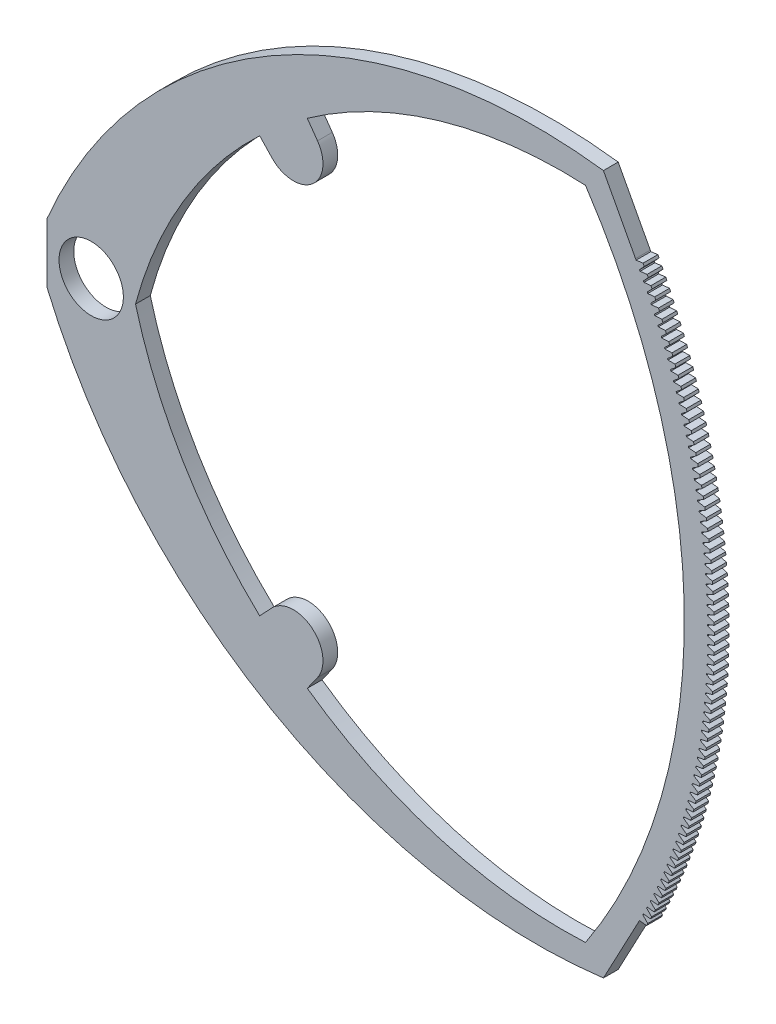
from build123d import *

# Parameters (mm, degrees)
SKETCH3_R           = 10.9
BOSS_EXTRUDE2_DEPTH = 5


with BuildPart() as part:
    # Sketch3 → Boss-Extrude2 (new body)
    with BuildSketch(Plane.XY):
        with BuildLine():
            Line((-15, -10), (-15, 10))
            ThreePointArc((-15, 10), (61.011584586, 95.857487867), (173.446009936, 118.391222805))
            Line((173.446009936, 118.391222805), (184.315310009, 98.002188732))
            ThreePointArc((184.315310009, 98.002188732), (184.412613698, 97.818967533), (184.509735253, 97.635649724))
            Line((184.509735253, 97.635649724), (186.879817898, 97.963940623))
            ThreePointArc((186.879817898, 97.963940623), (187.08601239, 97.569585261), (187.291374711, 97.174795903))
            Line((187.291374711, 97.174795903), (185.665667925, 95.419192273))
            ThreePointArc((185.665667925, 95.419192273), (185.760403961, 95.234630363), (185.854956533, 95.049974394))
            Line((185.854956533, 95.049974394), (188.229391809, 95.345141771))
            ThreePointArc((188.229391809, 95.345141771), (188.430060141, 94.947945925), (188.629890324, 94.550327744))
            Line((188.629890324, 94.550327744), (186.97982995, 92.817593655))
            ThreePointArc((186.97982995, 92.817593655), (187.071979865, 92.631727013), (187.16394502, 92.445768883))
            Line((187.16394502, 92.445768883), (189.542270026, 92.707755195))
            ThreePointArc((189.542270026, 92.707755195), (189.737373078, 92.307796299), (189.931632165, 91.907426811))
            Line((189.931632165, 91.907426811), (188.257539887, 90.197900062))
            ThreePointArc((188.257539887, 90.197900062), (188.347085716, 90.010764924), (188.436445526, 89.823540887))
            Line((188.436445526, 89.823540887), (190.818196602, 90.052295059))
            ThreePointArc((190.818196602, 90.052295059), (191.007696338, 89.649651085), (191.196346459, 89.246608343))
            Line((191.196346459, 89.246608343), (189.498548644, 87.560622211))
            ThreePointArc((189.498548644, 87.560622211), (189.58547293, 87.372255058), (189.672209973, 87.183801614))
            Line((189.672209973, 87.183801614), (192.056922793, 87.379279049))
            ThreePointArc((192.056922793, 87.379279049), (192.240782269, 86.974028494), (192.423786646, 86.568391072))
            Line((192.423786646, 86.568391072), (190.702614283, 84.906274242))
            ThreePointArc((190.702614283, 84.906274242), (190.78690008, 84.716711799), (190.870997448, 84.527065685))
            Line((190.870997448, 84.527065685), (193.258207106, 84.689228276))
            ThreePointArc((193.258207106, 84.689228276), (193.436390479, 84.281450144), (193.613713434, 83.873297122))
            Line((193.613713434, 83.873297122), (191.86950207, 82.235373627))
            ThreePointArc((191.86950207, 82.235373627), (191.951132946, 82.044652848), (192.032574243, 81.853851038))
            Line((192.032574243, 81.853851038), (194.421815349, 81.98266717))
            ThreePointArc((194.421815349, 81.98266717), (194.594287882, 81.572440958), (194.765894846, 81.161851906))
            Line((194.765894846, 81.161851906), (192.998984517, 79.548441063))
            ThreePointArc((192.998984517, 79.548441063), (193.077944558, 79.35659913), (193.156713907, 79.16467882))
            Line((193.156713907, 79.16467882), (195.547520674, 79.260123381))
            ThreePointArc((195.547520674, 79.260123381), (195.714248742, 78.847529063), (195.88010626, 78.434584027))
            Line((195.88010626, 78.434584027), (194.090841429, 76.846000373))
            ThreePointArc((194.090841429, 76.846000373), (194.167115242, 76.653074685), (194.243197287, 76.460073291))
            Line((194.243197287, 76.460073291), (196.635103622, 76.522127673))
            ThreePointArc((196.635103622, 76.522127673), (196.796054722, 76.107245686), (196.95613046, 75.692025169))
            Line((196.95613046, 75.692025169), (195.144859948, 74.128578403))
            ThreePointArc((195.144859948, 74.128578403), (195.218432662, 73.934606572), (195.291812571, 73.74056172))
            Line((195.291812571, 73.74056172), (197.684352167, 73.769213825))
            ThreePointArc((197.684352167, 73.769213825), (197.839494921, 73.352125051), (197.993757672, 72.934710002))
            Line((197.993757672, 72.934710002), (196.160834589, 71.396704919))
            ThreePointArc((196.160834589, 71.396704919), (196.231691862, 71.20172476), (196.302355329, 71.00667428))
            Line((196.302355329, 71.00667428), (198.695061756, 71.001918523))
            ThreePointArc((198.695061756, 71.001918523), (198.844365918, 70.582704274), (198.992785608, 70.163176068))
            Line((198.992785608, 70.163176068), (197.138567287, 68.650912507))
            ThreePointArc((197.138567287, 68.650912507), (197.206695305, 68.454962032), (197.274628554, 68.258943948))
            Line((197.274628554, 68.258943948), (199.667035348, 68.220781256))
            ThreePointArc((199.667035348, 68.220781256), (199.810471813, 67.799523258), (199.953019507, 67.377963684))
            Line((199.953019507, 67.377963684), (198.077867431, 65.891736463))
            ThreePointArc((198.077867431, 65.891736463), (198.143252912, 65.694853872), (198.208442699, 65.497906399))
            Line((198.208442699, 65.497906399), (200.600083457, 65.426344212))
            ThreePointArc((200.600083457, 65.426344212), (200.737624259, 65.003124591), (200.874272168, 64.579615833))
            Line((200.874272168, 64.579615833), (198.978551902, 63.119714694))
            ThreePointArc((198.978551902, 63.119714694), (199.0411821, 62.921938371), (199.103615716, 62.724099904))
            Line((199.103615716, 62.724099904), (201.494024182, 62.619152173))
            ThreePointArc((201.494024182, 62.619152173), (201.625642509, 62.194053437), (201.756363992, 61.768678057))
            Line((201.756363992, 61.768678057), (199.84044511, 60.335387612))
            ThreePointArc((199.84044511, 60.335387612), (199.900307814, 60.136756114), (199.959973088, 59.938065222))
            Line((199.959973088, 59.938065222), (202.348683248, 59.799752406))
            ThreePointArc((202.348683248, 59.799752406), (202.47435344, 59.372857428), (202.599123012, 58.945698355))
            Line((202.599123012, 58.945698355), (200.663379027, 57.539298027))
            ThreePointArc((200.663379027, 57.539298027), (200.720462567, 57.339850076), (200.777347868, 57.140345494))
            Line((200.777347868, 57.140345494), (203.163894037, 56.968694559))
            ThreePointArc((203.163894037, 56.968694559), (203.283591594, 56.540086563), (203.402384933, 56.111227073))
            Line((203.402384933, 56.111227073), (201.447193221, 54.731991041))
            ThreePointArc((201.447193221, 54.731991041), (201.501486469, 54.531765521), (201.555580705, 54.331486144))
            Line((201.555580705, 54.331486144), (203.939497622, 54.126530553))
            ThreePointArc((203.939497622, 54.126530553), (204.05319921, 53.696293096), (204.165993155, 53.265816796))
            Line((204.165993155, 53.265816796), (202.191734886, 51.914013946))
            ThreePointArc((202.191734886, 51.914013946), (202.243227256, 51.713049891), (202.294519883, 51.512034762))
            Line((202.294519883, 51.512034762), (204.675342798, 51.273814471))
            ThreePointArc((204.675342798, 51.273814471), (204.78302625, 50.842031431), (204.889798813, 50.410022242))
            Line((204.889798813, 50.410022242), (202.896858871, 49.08591611))
            ThreePointArc((202.896858871, 49.08591611), (202.945540326, 48.884252699), (202.994021343, 48.682541007))
            Line((202.994021343, 48.682541007), (205.371286111, 48.411102458))
            ThreePointArc((205.371286111, 48.411102458), (205.472930433, 47.977858011), (205.573660798, 47.544400154))
            Line((205.573660798, 47.544400154), (203.562427711, 46.248248878))
            ThreePointArc((203.562427711, 46.248248878), (203.60828876, 46.045925425), (203.653948717, 45.843556495))
            Line((203.653948717, 45.843556495), (206.027191884, 45.538952605))
            ThreePointArc((206.027191884, 45.538952605), (206.122777261, 45.104331212), (206.217445791, 44.669509192))
            Line((206.217445791, 44.669509192), (204.188311653, 43.401565458))
            ThreePointArc((204.188311653, 43.401565458), (204.231343355, 43.198621406), (204.27417335, 42.99563469))
            Line((204.27417335, 42.99563469), (206.642932248, 42.657924843))
            ThreePointArc((206.642932248, 42.657924843), (206.732440046, 42.222011234), (206.821028284, 41.78590982))
            Line((206.821028284, 41.78590982), (204.774388679, 40.546420817))
            ThreePointArc((204.774388679, 40.546420817), (204.814582645, 40.342895731), (204.854574327, 40.139330801))
            Line((204.854574327, 40.139330801), (207.218387163, 39.768580833))
            ThreePointArc((207.218387163, 39.768580833), (207.301799932, 39.331459992), (207.384290608, 38.894164202))
            Line((207.384290608, 38.894164202), (205.320544532, 37.683371571))
            ThreePointArc((205.320544532, 37.683371571), (205.357892926, 37.479305128), (205.3950385, 37.27520167))
            Line((205.3950385, 37.27520167), (207.753444443, 36.87148386))
            ThreePointArc((207.753444443, 36.87148386), (207.830745921, 36.433241004), (207.907122954, 35.99483609))
            Line((207.907122954, 35.99483609), (205.826672738, 34.812975877))
            ThreePointArc((205.826672738, 34.812975877), (205.861168279, 34.608407861), (205.895460503, 34.403805664))
            Line((205.895460503, 34.403805664), (208.247999777, 33.967198718))
            ThreePointArc((208.247999777, 33.967198718), (208.319174894, 33.527919283), (208.389423394, 33.088490713))
            Line((208.389423394, 33.088490713), (206.292674627, 31.935793324))
            ThreePointArc((206.292674627, 31.935793324), (206.32431059, 31.730763616), (206.355742778, 31.525702569))
            Line((206.355742778, 31.525702569), (208.701956751, 31.056291604))
            ThreePointArc((208.701956751, 31.056291604), (208.766991632, 30.616061228), (208.831097903, 30.17569467))
            Line((208.831097903, 30.17569467), (206.71845935, 29.052384825))
            ThreePointArc((206.71845935, 29.052384825), (206.747229567, 28.846933395), (206.775795592, 28.641453475))
            Line((206.775795592, 28.641453475), (209.115226865, 28.139330004))
            ThreePointArc((209.115226865, 28.139330004), (209.17410883, 27.698234511), (209.232060375, 27.257015815))
            Line((209.232060375, 27.257015815), (207.103943899, 26.163312507))
            ThreePointArc((207.103943899, 26.163312507), (207.129842762, 25.957479408), (207.155537055, 25.751620673))
            Line((207.155537055, 25.751620673), (209.487729552, 25.216882586))
            ThreePointArc((209.487729552, 25.216882586), (209.540447122, 24.775007968), (209.592232643, 24.33302315))
            Line((209.592232643, 24.33302315), (207.449053125, 23.269139598))
            ThreePointArc((207.449053125, 23.269139598), (207.472075584, 23.062964959), (207.494893136, 22.856767541))
            Line((207.494893136, 22.856767541), (209.81939219, 22.289519086))
            ThreePointArc((209.81939219, 22.289519086), (209.865935089, 21.846951489), (209.91154449, 21.404286715))
            Line((209.91154449, 21.404286715), (207.753719746, 20.370430325))
            ThreePointArc((207.753719746, 20.370430325), (207.773861314, 20.163954339), (207.793797676, 19.957458438))
            Line((207.793797676, 19.957458438), (210.110150122, 19.357810201))
            ThreePointArc((210.110150122, 19.357810201), (210.150509275, 18.914635903), (210.189933666, 18.471377471))
            Line((210.189933666, 18.471377471), (208.017884368, 17.467749796))
            ThreePointArc((208.017884368, 17.467749796), (208.035141118, 17.261012716), (208.052192404, 17.054258588))
            Line((208.052192404, 17.054258588), (210.359946664, 16.422327472))
            ThreePointArc((210.359946664, 16.422327472), (210.394114204, 15.978632871), (210.427345897, 15.534867196))
            Line((210.427345897, 15.534867196), (208.241495492, 14.561663894))
            ThreePointArc((208.241495492, 14.561663894), (208.255864059, 14.354706024), (208.270026944, 14.147733977))
            Line((208.270026944, 14.147733977), (210.568733117, 13.483643178))
            ThreePointArc((210.568733117, 13.483643178), (210.596702383, 13.039514773), (210.6237349, 12.595328368))
            Line((210.6237349, 12.595328368), (208.424509523, 11.652739167))
            ThreePointArc((208.424509523, 11.652739167), (208.435987107, 11.445600855), (208.44725883, 11.238451238))
            Line((208.44725883, 11.238451238), (210.736468779, 10.542330221))
            ThreePointArc((210.736468779, 10.542330221), (210.758234317, 10.097854596), (210.779062389, 9.653334055))
            Line((210.779062389, 9.653334055), (208.566890783, 8.741542716))
            ThreePointArc((208.566890783, 8.741542716), (208.575475145, 8.534264342), (208.58385351, 8.326977539))
            Line((208.58385351, 8.326977539), (210.863120949, 7.598962016))
            ThreePointArc((210.863120949, 7.598962016), (210.878678517, 7.154225822), (210.893298082, 6.709457806))
            Line((210.893298082, 6.709457806), (208.668611515, 5.828642084))
            ThreePointArc((208.668611515, 5.828642084), (208.674300982, 5.621264058), (208.679784354, 5.413880481))
            Line((208.679784354, 5.413880481), (210.948664935, 4.654112378))
            ThreePointArc((210.948664935, 4.654112378), (210.9580115, 4.209202318), (210.966419709, 3.764273535))
            Line((210.966419709, 3.764273535), (208.729651887, 2.914605146))
            ThreePointArc((208.729651887, 2.914605146), (208.73244535, 2.707167897), (208.735032661, 2.499727975))
            Line((208.735032661, 2.499727975), (210.993084062, 1.708355411))
            ThreePointArc((210.993084062, 1.708355411), (210.9962178, 1.263358221), (210.998413014, 0.818355411))
            Line((210.998413014, 0.818355411), (208.75, 0))
            ThreePointArc((208.75, 0), (208.749896915, -0.207456031), (208.74958766, -0.414911858))
            Line((208.74958766, -0.414911858), (210.996369668, -1.237734602))
            ThreePointArc((210.996369668, -1.237734602), (210.99328997, -1.68273217), (210.98927176, -2.127722252))
            Line((210.98927176, -2.127722252), (208.729651887, -2.914605146))
            ThreePointArc((208.729651887, -2.914605146), (208.726652273, -3.122039516), (208.723446513, -3.329470802))
            Line((208.723446513, -3.329470802), (210.958521114, -4.183583317))
            ThreePointArc((210.958521114, -4.183583317), (210.94922858, -4.628494509), (210.93899773, -5.073385112))
            Line((210.93899773, -5.073385112), (208.668611515, -5.828642084))
            ThreePointArc((208.668611515, -5.828642084), (208.662715957, -6.036014353), (208.656614316, -6.24338066))
            Line((208.656614316, -6.24338066), (210.879545778, -7.128616434))
            ThreePointArc((210.879545778, -7.128616434), (210.86404222, -7.573354513), (210.847600725, -8.018058906))
            Line((210.847600725, -8.018058906), (208.566890783, -8.741542716))
            ThreePointArc((208.566890783, -8.741542716), (208.558100432, -8.948812456), (208.549104099, -9.156073358))
            Line((208.549104099, -9.156073358), (210.759459058, -10.072259813))
            ThreePointArc((210.759459058, -10.072259813), (210.737747497, -10.516738078), (210.715098562, -10.961169563))
            Line((210.715098562, -10.961169563), (208.424509523, -11.652739167))
            ThreePointArc((208.424509523, -11.652739167), (208.412826091, -11.859865971), (208.400936821, -12.066981062))
            Line((208.400936821, -12.066981062), (210.598284363, -13.013939585))
            ThreePointArc((210.598284363, -13.013939585), (210.570369033, -13.458071383), (210.541517072, -13.902143319))
            Line((210.541517072, -13.902143319), (208.241495492, -14.561663894))
            ThreePointArc((208.241495492, -14.561663894), (208.226921257, -14.768607382), (208.212141368, -14.975536284))
            Line((208.212141368, -14.975536284), (210.396053115, -15.953082264))
            ThreePointArc((210.396053115, -15.953082264), (210.361939458, -16.396781011), (210.326890097, -16.840406824))
            Line((210.326890097, -16.840406824), (208.017884368, -17.467749796))
            ThreePointArc((208.017884368, -17.467749796), (208.000422172, -17.674469623), (207.982754545, -17.881171995))
            Line((207.982754545, -17.881171995), (210.15280474, -18.889114857))
            ThreePointArc((210.15280474, -18.889114857), (210.112499406, -19.332294053), (210.071259478, -19.775387258))
            Line((210.071259478, -19.775387258), (207.753719746, -20.370430325))
            ThreePointArc((207.753719746, -20.370430325), (207.733372992, -20.576886192), (207.712821072, -20.783321737))
            Line((207.712821072, -20.783321737), (209.868586659, -21.821464981))
            ThreePointArc((209.868586659, -21.821464981), (209.822097506, -22.264038227), (209.774675051, -22.706512442))
            Line((209.774675051, -22.706512442), (207.449053125, -23.269139598))
            ThreePointArc((207.449053125, -23.269139598), (207.42582578, -23.475291256), (207.402393573, -23.681419728))
            Line((207.402393573, -23.681419728), (209.543454281, -24.749560966))
            ThreePointArc((209.543454281, -24.749560966), (209.490790372, -25.191441982), (209.437194635, -25.633210945))
            Line((209.437194635, -25.633210945), (207.103943899, -26.163312507))
            ThreePointArc((207.103943899, -26.163312507), (207.077840492, -26.369119765), (207.051532566, -26.57490098))
            Line((207.051532566, -26.57490098), (209.177470992, -27.672831976))
            ThreePointArc((209.177470992, -27.672831976), (209.118642594, -28.113934616), (209.058884023, -28.554912204))
            Line((209.058884023, -28.554912204), (206.71845935, -29.052384825))
            ThreePointArc((206.71845935, -29.052384825), (206.689484969, -29.257807562), (206.660306453, -29.463201403))
            Line((206.660306453, -29.463201403), (208.77070814, -30.590708112))
            ThreePointArc((208.77070814, -30.590708112), (208.705726722, -31.030946383), (208.639816968, -31.471046626))
            Line((208.639816968, -31.471046626), (206.292674627, -31.935793324))
            ThreePointArc((206.292674627, -31.935793324), (206.260834921, -32.140791492), (206.228791503, -32.345757916))
            Line((206.228791503, -32.345757916), (208.323245025, -33.502620529))
            ThreePointArc((208.323245025, -33.502620529), (208.252123255, -33.941908605), (208.180075166, -34.381045705))
            Line((208.180075166, -34.381045705), (205.826672738, -34.812975877))
            ThreePointArc((205.826672738, -34.812975877), (205.791973915, -35.01750951), (205.757071842, -35.222008559))
            Line((205.757071842, -35.222008559), (207.83516888, -36.408001544))
            ThreePointArc((207.83516888, -36.408001544), (207.757920624, -36.846253785), (207.679748247, -37.284342131))
            Line((207.679748247, -37.284342131), (205.320544532, -37.683371571))
            ThreePointArc((205.320544532, -37.683371571), (205.282993355, -37.887400796), (205.245239432, -38.091392602))
            Line((205.245239432, -38.091392602), (207.306574858, -39.306284747))
            ThreePointArc((207.306574858, -39.306284747), (207.223215175, -39.743415714), (207.138933749, -40.1803699))
            Line((207.138933749, -40.1803699), (204.774388679, -40.546420817))
            ThreePointArc((204.774388679, -40.546420817), (204.73399247, -40.749905858), (204.693394056, -40.953350652))
            Line((204.693394056, -40.953350652), (206.737566008, -42.196905111))
            ThreePointArc((206.737566008, -42.196905111), (206.648111149, -42.632829586), (206.557737106, -43.068564427))
            Line((206.557737106, -43.068564427), (204.188311653, -43.401565458))
            ThreePointArc((204.188311653, -43.401565458), (204.145078287, -43.604466645), (204.101643298, -43.807324766))
            Line((204.101643298, -43.807324766), (206.12825326, -45.079299106))
            ThreePointArc((206.12825326, -45.079299106), (206.032720665, -45.513932103), (205.936271622, -45.948362652))
            Line((205.936271622, -45.948362652), (203.562427711, -46.248248878))
            ThreePointArc((203.562427711, -46.248248878), (203.516365616, -46.450526655), (203.470102519, -46.652758555))
            Line((203.470102519, -46.652758555), (205.478755401, -47.952904801))
            ThreePointArc((205.478755401, -47.952904801), (205.377163693, -48.386161589), (205.274658454, -48.819203153))
            Line((205.274658454, -48.819203153), (202.896858871, -49.08591611))
            ThreePointArc((202.896858871, -49.08591611), (202.847977027, -49.287531042), (202.798894841, -49.489097296))
            Line((202.798894841, -49.489097296), (204.789199051, -50.817161983))
            ThreePointArc((204.789199051, -50.817161983), (204.681568037, -51.248958097), (204.573026585, -51.680526253))
            Line((204.573026585, -51.680526253), (202.191734886, -51.914013946))
            ThreePointArc((202.191734886, -51.914013946), (202.140042822, -52.114926728), (202.088151117, -52.31578804))
            Line((202.088151117, -52.31578804), (204.059718641, -53.671512259))
            ThreePointArc((204.059718641, -53.671512259), (203.946069303, -54.101763519), (203.831512799, -54.531774132))
            Line((203.831512799, -54.531774132), (201.447193221, -54.731991041))
            ThreePointArc((201.447193221, -54.731991041), (201.392701016, -54.932162506), (201.338009907, -55.132279717))
            Line((201.338009907, -55.132279717), (203.290456385, -56.515399166))
            ThreePointArc((203.290456385, -56.515399166), (203.170810879, -56.944021696), (203.050261656, -57.372390934))
            Line((203.050261656, -57.372390934), (200.663379027, -57.539298027))
            ThreePointArc((200.663379027, -57.539298027), (200.606097303, -57.738689149), (200.548617453, -57.938023246))
            Line((200.548617453, -57.938023246), (202.481562251, -59.348268285))
            ThreePointArc((202.481562251, -59.348268285), (202.355943903, -59.775178522), (202.229425462, -60.201822875))
            Line((202.229425462, -60.201822875), (199.84044511, -60.335387612))
            ThreePointArc((199.84044511, -60.335387612), (199.780385035, -60.533959521), (199.720127649, -60.732471644))
            Line((199.720127649, -60.732471644), (201.633193935, -62.169567341))
            ThreePointArc((201.633193935, -62.169567341), (201.501627234, -62.594682058), (201.36916424, -63.01951835))
            Line((201.36916424, -63.01951835), (198.978551902, -63.119714694))
            ThreePointArc((198.978551902, -63.119714694), (198.915725185, -63.317428677), (198.85270201, -63.515080126))
            Line((198.85270201, -63.515080126), (200.745516829, -64.978746317))
            ThreePointArc((200.745516829, -64.978746317), (200.608027424, -65.401982638), (200.469645702, -65.824928046))
            Line((200.469645702, -65.824928046), (198.077867431, -65.891736463))
            ThreePointArc((198.077867431, -65.891736463), (198.012286319, -66.088553976), (197.946509643, -66.285306217))
            Line((197.946509643, -66.285306217), (199.818703987, -67.775257558))
            ThreePointArc((199.818703987, -67.775257558), (199.675318682, -68.196532971), (199.531045208, -68.617505042))
            Line((199.531045208, -68.617505042), (197.138567287, -68.650912507))
            ThreePointArc((197.138567287, -68.650912507), (197.070244567, -68.846795179), (197.001727211, -69.042609856))
            Line((197.001727211, -69.042609856), (198.852936092, -70.558555878))
            ThreePointArc((198.852936092, -70.558555878), (198.703682841, -70.977788255), (198.553545742, -71.396704919))
            Line((198.553545742, -71.396704919), (196.160834589, -71.396704919))
            ThreePointArc((196.160834589, -71.396704919), (196.089783579, -71.591614564), (196.018538903, -71.786453501))
            Line((196.018538903, -71.786453501), (197.848401424, -73.328098667))
            ThreePointArc((197.848401424, -73.328098667), (197.693309322, -73.745206279), (197.537337869, -74.161985867))
            Line((197.537337869, -74.161985867), (195.144859948, -74.128578403))
            ThreePointArc((195.144859948, -74.128578403), (195.0710945, -74.322477021), (194.997136392, -74.516302236))
            Line((194.997136392, -74.516302236), (196.805295817, -76.083345999))
            ThreePointArc((196.805295817, -76.083345999), (196.644395102, -76.498247529), (196.4826197, -76.912808789))
            Line((196.4826197, -76.912808789), (194.090841429, -76.846000373))
            ThreePointArc((194.090841429, -76.846000373), (194.014375924, -77.038850164), (193.937718803, -77.231623869))
            Line((193.937718803, -77.231623869), (195.723822628, -78.823760731))
            ThreePointArc((195.723822628, -78.823760731), (195.557144667, -79.236375293), (195.389596855, -79.648637407))
            Line((195.389596855, -79.648637407), (192.998984517, -79.548441063))
            ThreePointArc((192.998984517, -79.548441063), (192.919833862, -79.740204431), (192.840492671, -79.931889045))
            Line((192.840492671, -79.931889045), (194.604192692, -81.548808615))
            ThreePointArc((194.604192692, -81.548808615), (194.43176998, -81.959055769), (194.258482421, -82.368938365))
            Line((194.258482421, -82.368938365), (191.86950207, -82.235373627))
            ThreePointArc((191.86950207, -82.235373627), (191.787681695, -82.426013187), (191.705671904, -82.61657134))
            Line((191.705671904, -82.61657134), (193.446624284, -84.257958397))
            ThreePointArc((193.446624284, -84.257958397), (193.268490433, -84.665758165), (193.089496912, -85.073181335))
            Line((193.089496912, -85.073181335), (190.702614283, -84.906274242))
            ThreePointArc((190.702614283, -84.906274242), (190.61814014, -85.095752829), (190.533477735, -85.285147371))
            Line((190.533477735, -85.285147371), (192.251343072, -86.950681923))
            ThreePointArc((192.251343072, -86.950681923), (192.067532811, -87.355954804), (191.882868222, -87.76083912))
            Line((191.882868222, -87.76083912), (189.498548644, -87.560622211))
            ThreePointArc((189.498548644, -87.560622211), (189.411437201, -87.748902884), (189.324138688, -87.937096894))
            Line((189.324138688, -87.937096894), (191.01858208, -89.626454242))
            ThreePointArc((191.01858208, -89.626454242), (190.829131244, -90.029121226), (190.638831587, -90.431387755))
            Line((190.638831587, -90.431387755), (188.257539887, -90.197900062))
            ThreePointArc((188.257539887, -90.197900062), (188.167808127, -90.384946118), (188.077890525, -90.571902905))
            Line((188.077890525, -90.571902905), (189.748581638, -92.284753706))
            ThreePointArc((189.748581638, -92.284753706), (189.553527159, -92.684736293), (189.357629533, -93.084306612))
            Line((189.357629533, -93.084306612), (186.97982995, -92.817593655))
            ThreePointArc((186.97982995, -92.817593655), (186.887495366, -93.003368627), (186.794976204, -93.189051744))
            Line((186.794976204, -93.189051744), (188.441589333, -94.925062074))
            ThreePointArc((188.441589333, -94.925062074), (188.240969238, -95.322282286), (188.039511835, -95.719078499))
            Line((188.039511835, -95.719078499), (185.665667925, -95.419192273))
            Line((185.665667925, -95.419192273), (173.446009936, -118.391222805))
            ThreePointArc((173.446009936, -118.391222805), (61.011584586, -95.857487867), (-15, -10))
        make_face()
        Circle(SKETCH3_R, mode=Mode.SUBTRACT)
        with BuildLine():
            Line((57.043637479, 70.391116557), (61.157764114, 66.023741827))
            ThreePointArc((61.157764114, 66.023741827), (74.804508493, 65.140931053), (76.632878585, 78.693423437))
            Line((76.632878585, 78.693423437), (73.163548386, 83.588701567))
            ThreePointArc((73.163548386, 83.588701567), (117.965153004, 105.22666603), (167.379957184, 111.019973395))
            ThreePointArc((167.379957184, 111.019973395), (200.851897078, 0), (167.379957184, -111.019973395))
            ThreePointArc((167.379957184, -111.019973395), (117.965153004, -105.22666603), (73.163548386, -83.588701567))
            Line((73.163548386, -83.588701567), (76.632878585, -78.693423437))
            ThreePointArc((76.632878585, -78.693423437), (74.804508493, -65.140931053), (61.157764114, -66.023741827))
            Line((61.157764114, -66.023741827), (57.043637479, -70.391116557))
            ThreePointArc((57.043637479, -70.391116557), (31.11893594, -38.123982164), (15, 0))
            ThreePointArc((15, 0), (31.11893594, 38.123982164), (57.043637479, 70.391116557))
        make_face(mode=Mode.SUBTRACT)
    extrude(amount=BOSS_EXTRUDE2_DEPTH)


solid = part.part
